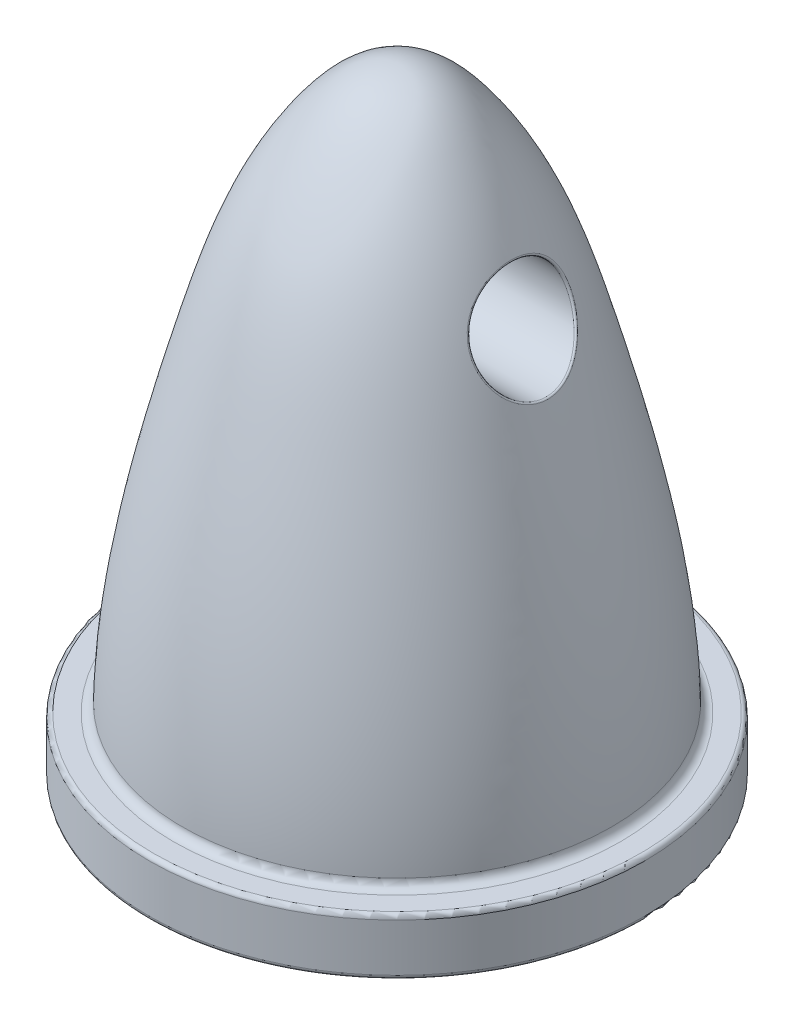
from build123d import *

# Parameters (mm, degrees)
FILLET1_R               = 0.254
CUT_EXTRUDE1_DEPTH      = 21.759291338
CUT_EXTRUDE1_DEPTH_BACK = 21.759291338
SKETCH2_R               = 1.4351
FILLET2_R               = 0.0508
SKETCH3_R               = 2.54
CUT_EXTRUDE2_DEPTH      = 9.7028
FILLET3_R               = 0.127


with BuildPart() as part:
    # Sketch1 → Revolve1 (revolve)
    with BuildSketch(Plane.XY, mode=Mode.PRIVATE) as revolve1_sk:
        with BuildLine():
            Line((7.239, 1.651), (6.2738, 1.651))
            add(Edge.make_bspline(
                [(0, 18.0594), (1.001064055, 18.0594), (3.232153943, 15.732976491), (4.98888916, 10.043556143), (6.2738, 4.562941892), (6.2738, 1.651)],
                knots=[0, 0, 0, 0, 0.146162561, 0.478560643, 1, 1, 1, 1], degree=3))
            Line((0, 18.0594), (0, 1.651))
            Line((0, 1.651), (0, 0))
            Line((0, 0), (7.239, 0))
            Line((7.239, 0), (7.239, 1.651))
        make_face()
    revolve(revolve1_sk.sketch.rotate(Axis((0, 0, 0), (0, 1, 0)), 90), axis=Axis((0, 0, 0), (0, 1, 0)))

    # Fillet1
    fillet1_edges = [part.edges().sort_by_distance(p)[0] for p in [
        (0, 1.651, 6.2738),
    ]]
    fillet(fillet1_edges, radius=FILLET1_R)

    # Sketch2 → Cut-Extrude1 (cut, two sides: drawn at the far end of the back side and taken through both)
    with BuildSketch(Plane(origin=(0, 0, 0), x_dir=(0, 0, -1), z_dir=(1, 0, 0)).offset(-CUT_EXTRUDE1_DEPTH_BACK)):
        with Locations((0, 13.2588)):
            Circle(SKETCH2_R)
    extrude(amount=CUT_EXTRUDE1_DEPTH + CUT_EXTRUDE1_DEPTH_BACK, mode=Mode.SUBTRACT)

    # Fillet2
    fillet2_edges = [part.edges().sort_by_distance(p)[0] for p in [
        (3.7044256, 13.170038335, 1.432352392),
        (-3.704425611, 13.170038344, 1.432352347),
    ]]
    fillet(fillet2_edges, radius=FILLET2_R)

    # Sketch3 → Cut-Extrude2 (cut)
    with BuildSketch(Plane.XZ):
        with Locations(Location((0, 0, 0), (0, 0, 270))):
            Circle(SKETCH3_R)
    extrude(amount=-CUT_EXTRUDE2_DEPTH, mode=Mode.SUBTRACT)

    # Fillet3
    fillet3_edges = [part.edges().sort_by_distance(p)[0] for p in [
        (0, 0, 2.54),
        (0, 1.651, 7.239),
        (0, 0, 7.239),
    ]]
    fillet(fillet3_edges, radius=FILLET3_R)


solid = part.part
